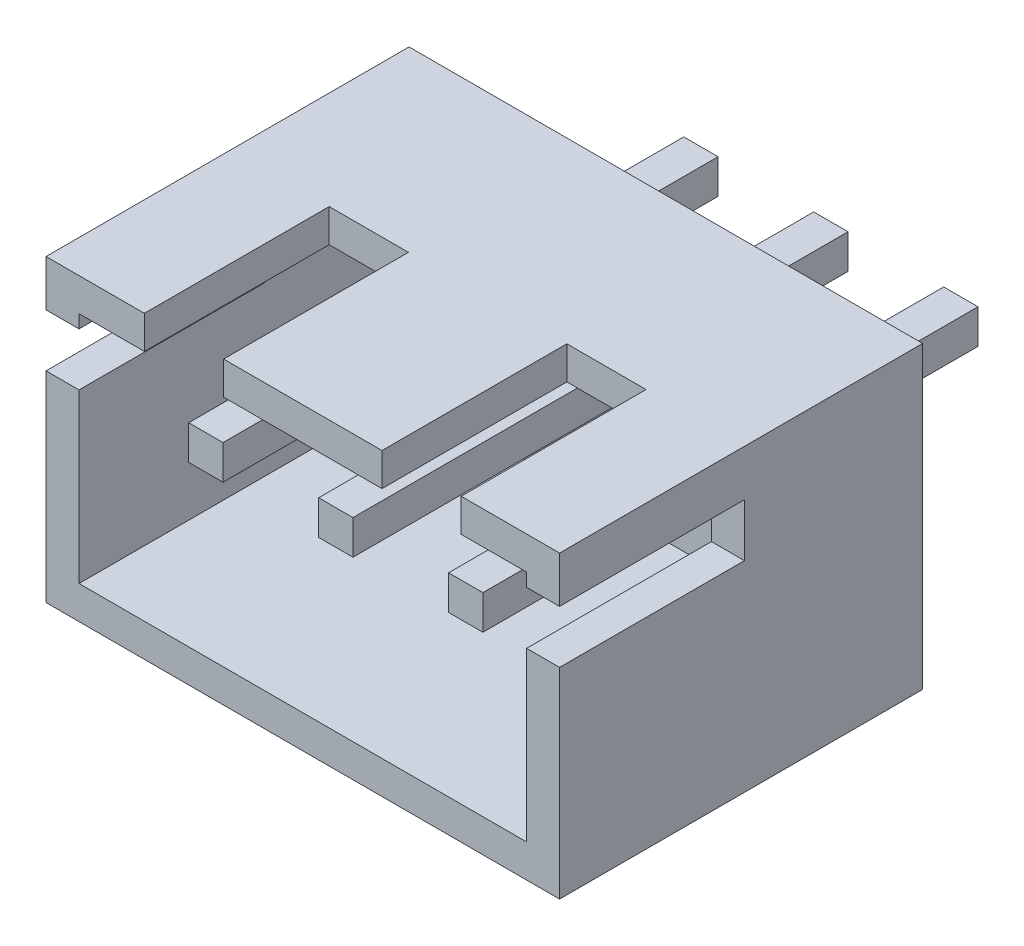
from build123d import *

# Parameters (mm, degrees)
SKETCH1_W           = 9.8806
SKETCH1_H           = 5.7658
BOSS_EXTRUDE1_DEPTH = 6.985
SKETCH2_W           = 0.6604
SKETCH2_H           = 0.6604
BOSS_EXTRUDE2_DEPTH = 3.175
SKETCH4_W           = 8.6106
SKETCH4_H           = 4.4958
CUT_EXTRUDE1_DEPTH  = 6.35
SKETCH2_2_W         = 0.6604
SKETCH2_2_H         = 0.6604
BOSS_EXTRUDE3_DEPTH = 6.35
SKETCH5_W           = 0.635
SKETCH5_H           = 1.016
SKETCH5_W_2         = 1.524
SKETCH5_H_2         = 0.635
CUT_EXTRUDE2_DEPTH  = 3.556


with BuildPart() as part:
    # Sketch1 → Boss-Extrude1 (new body)
    with BuildSketch(Plane.XY):
        with Locations((4.9403, 2.8829)):
            Rectangle(SKETCH1_W, SKETCH1_H)
    extrude(amount=BOSS_EXTRUDE1_DEPTH)

    # Sketch2 → Boss-Extrude2 (add)
    with BuildSketch(Plane(origin=(0, 0, 0), x_dir=(-1, 0, 0), z_dir=(0, 0, -1))):
        with Locations((-7.4403, 3.4036)):
            Rectangle(SKETCH2_W, SKETCH2_H)
        with Locations((-4.9403, 3.4036)):
            Rectangle(SKETCH2_W, SKETCH2_H)
        with Locations((-2.4403, 3.4036)):
            Rectangle(SKETCH2_W, SKETCH2_H)
    extrude(amount=BOSS_EXTRUDE2_DEPTH)

    # Sketch4 → Cut-Extrude1 (cut)
    with BuildSketch(Plane.XY.offset(6.985)):
        with Locations((4.9403, 2.8829)):
            Rectangle(SKETCH4_W, SKETCH4_H)
    extrude(amount=-CUT_EXTRUDE1_DEPTH, mode=Mode.SUBTRACT)

    # Sketch2<2> → Boss-Extrude3 (add)
    with BuildSketch(Plane(origin=(0, 0, 0), x_dir=(-1, 0, 0), z_dir=(0, 0, -1))):
        with Locations((-7.4403, 3.4036)):
            Rectangle(SKETCH2_2_W, SKETCH2_2_H)
        with Locations((-4.9403, 3.4036)):
            Rectangle(SKETCH2_2_W, SKETCH2_2_H)
        with Locations((-2.4403, 3.4036)):
            Rectangle(SKETCH2_2_W, SKETCH2_2_H)
    extrude(amount=-BOSS_EXTRUDE3_DEPTH)

    # Sketch5 → Cut-Extrude2 (cut)
    with BuildSketch(Plane.XY.offset(6.985)):
        with Locations((0.3175, 4.3688)):
            Rectangle(SKETCH5_W, SKETCH5_H)
        with Locations((9.5631, 4.3688)):
            Rectangle(SKETCH5_W, SKETCH5_H)
        with Locations((7.2263, 5.4483)):
            Rectangle(SKETCH5_W_2, SKETCH5_H_2)
        with Locations((2.6543, 5.4483)):
            Rectangle(SKETCH5_W_2, SKETCH5_H_2)
    extrude(amount=-CUT_EXTRUDE2_DEPTH, mode=Mode.SUBTRACT)


solid = part.part
